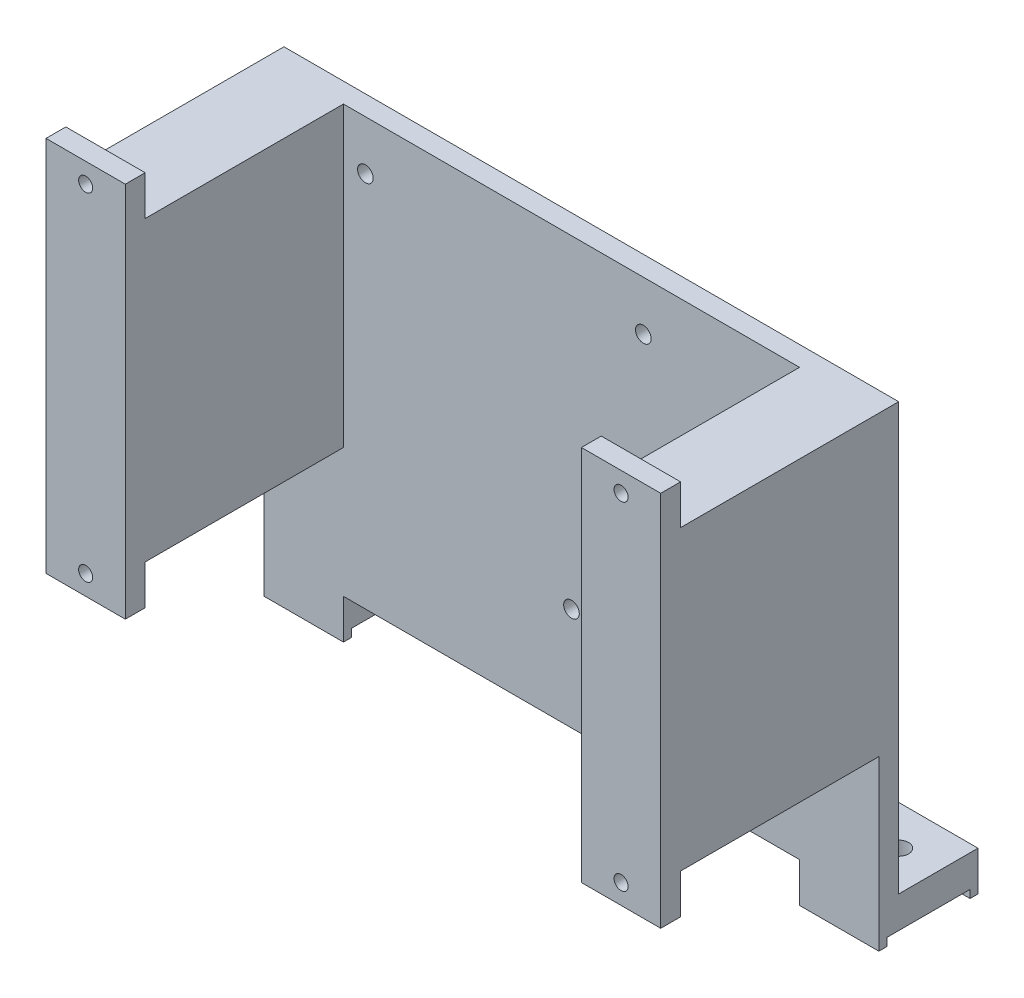
from build123d import *

# Parameters (mm, degrees)
SKETCH1_W                   = 196.85
SKETCH1_H                   = 82.55
BOSS_EXTRUDE1_DEPTH         = 95.25
SKETCH3_W                   = 146.05
SKETCH3_H                   = 76.2
CUT_EXTRUDE1_DEPTH          = 144.051280141
SKETCH4_W                   = 25.4
SKETCH4_H                   = 53.975
BOSS_EXTRUDE2_DEPTH         = 6.35
SKETCH5_W                   = 25.4
SKETCH5_H                   = 12.7
BOSS_EXTRUDE3_DEPTH         = 25.4
SKETCH6_W                   = 26.67
SKETCH6_H                   = 2.54
CUT_EXTRUDE2_DEPTH          = 229.622047548
F_1_4_0_25_DIAMETER_HOLE1_D = 6.35
SKETCH16_W                  = 196.85
SKETCH16_H                  = 6.35
CUT_EXTRUDE3_DEPTH          = 191.790819682
BOSS_EXTRUDE4_START         = -6.35
SKETCH11_W                  = 25.4
SKETCH11_H                  = 12.7
BOSS_EXTRUDE4_DEPTH         = 6.35
F_8_CLEARANCE_HOLE1_D       = 4.4958
F_8_CLEARANCE_HOLE1_DEPTH   = 12.7
SKETCH14_W                  = 146.05
SKETCH14_H                  = 41.275
BOSS_EXTRUDE5_DEPTH         = 6.35
M6X1_0_TAPPED_HOLE1_D       = 5
M6X1_0_TAPPED_HOLE1_DEPTH   = 14.986
M6X1_0_TAPPED_HOLE1_TIP     = 1.502151548


with BuildPart() as part:
    # Sketch1 → Boss-Extrude1 (new body)
    with BuildSketch(Plane(origin=(0, 0, 0), x_dir=(1, 0, 0), z_dir=(0, 1, 0))):
        Rectangle(SKETCH1_W, SKETCH1_H)
    extrude(amount=BOSS_EXTRUDE1_DEPTH)

    # Sketch3 → Cut-Extrude1 (cut, through all)
    with BuildSketch(Plane(origin=(0, 95.25, 0), x_dir=(1, 0, 0), z_dir=(0, 1, 0))):
        with Locations((0, -3.175)):
            Rectangle(SKETCH3_W, SKETCH3_H)
    extrude(amount=-CUT_EXTRUDE1_DEPTH, mode=Mode.SUBTRACT)

    # Sketch4 → Boss-Extrude2 (add)
    with BuildSketch(Plane(origin=(0, 0, -41.275), x_dir=(-1, 0, 0), z_dir=(0, 0, -1))):
        with Locations((-85.725, -26.9875)):
            Rectangle(SKETCH4_W, SKETCH4_H)
    boss_extrude2 = extrude(amount=-BOSS_EXTRUDE2_DEPTH)

    # Sketch5 → Boss-Extrude3 (add)
    with BuildSketch(Plane(origin=(0, 0, -41.275), x_dir=(-1, 0, 0), z_dir=(0, 0, -1))):
        with Locations((-85.725, -47.625)):
            Rectangle(SKETCH5_W, SKETCH5_H)
    boss_extrude3 = extrude(amount=BOSS_EXTRUDE3_DEPTH)

    # Sketch6 → Cut-Extrude2 (cut, through all)
    with BuildSketch(Plane(origin=(98.425, 0, 0), x_dir=(0, 0, -1), z_dir=(1, 0, 0))):
        with Locations((50.8, -52.705)):
            Rectangle(SKETCH6_W, SKETCH6_H)
    cut_extrude2 = extrude(amount=-CUT_EXTRUDE2_DEPTH, mode=Mode.SUBTRACT)

    # 1/4 (0.25) Diameter Hole1 (through all)
    with Locations(Plane(origin=(0, -41.275, 0), x_dir=(1, 0, 0), z_dir=(0, 1, 0))):
        with Locations((85.725, 53.975)):
            f_1_4_0_25_diameter_hole1 = Hole(F_1_4_0_25_DIAMETER_HOLE1_D / 2)

    # Sketch16 → Cut-Extrude3 (cut, through all)
    with BuildSketch(Plane(origin=(0, 95.25, 0), x_dir=(1, 0, 0), z_dir=(0, 1, 0))):
        with Locations((0, -38.1)):
            Rectangle(SKETCH16_W, SKETCH16_H)
    extrude(amount=-CUT_EXTRUDE3_DEPTH, mode=Mode.SUBTRACT)

    # Sketch11 → Boss-Extrude4 (add)
    with BuildSketch(Plane.XY.offset(41.275).offset(BOSS_EXTRUDE4_START)):
        with Locations((85.725, 101.6)):
            Rectangle(SKETCH11_W, SKETCH11_H)
        with Locations((85.725, -6.35)):
            Rectangle(SKETCH11_W, SKETCH11_H)
    boss_extrude4 = extrude(amount=-BOSS_EXTRUDE4_DEPTH)

    # #8 Clearance Hole1
    with Locations(Plane.XY.offset(41.275)):
        with Locations((85.725, 101.6), (85.725, -6.35)):
            f_8_clearance_hole1 = Hole(F_8_CLEARANCE_HOLE1_D / 2, depth=F_8_CLEARANCE_HOLE1_DEPTH)

    # Mirror1: Boss-Extrude2, Boss-Extrude3, Cut-Extrude2, 1/4 (0.25) Diameter Hole1, Boss-Extrude4, #8 Clearance Hole1 across plane
    add(boss_extrude2.mirror(Plane(origin=(0, 0, 0), x_dir=(0, 0, 1), z_dir=(1, 0, 0))))
    add(boss_extrude3.mirror(Plane(origin=(0, 0, 0), x_dir=(0, 0, 1), z_dir=(1, 0, 0))))
    add(cut_extrude2.mirror(Plane(origin=(0, 0, 0), x_dir=(0, 0, 1), z_dir=(1, 0, 0))), mode=Mode.SUBTRACT)
    add(f_1_4_0_25_diameter_hole1.mirror(Plane(origin=(0, 0, 0), x_dir=(0, 0, 1), z_dir=(1, 0, 0))), mode=Mode.SUBTRACT)
    add(boss_extrude4.mirror(Plane(origin=(0, 0, 0), x_dir=(0, 0, 1), z_dir=(1, 0, 0))))
    add(f_8_clearance_hole1.mirror(Plane(origin=(0, 0, 0), x_dir=(0, 0, 1), z_dir=(1, 0, 0))), mode=Mode.SUBTRACT)

    # Sketch14 → Boss-Extrude5 (add)
    with BuildSketch(Plane(origin=(0, 0, -41.275), x_dir=(-1, 0, 0), z_dir=(0, 0, -1))):
        with Locations((0, -20.6375)):
            Rectangle(SKETCH14_W, SKETCH14_H)
    extrude(amount=-BOSS_EXTRUDE5_DEPTH)

    # M6x1.0 Tapped Hole1
    with Locations(Plane(origin=(0, 0, -41.275), x_dir=(-1, 0, 0), z_dir=(0, 0, -1))):
        with Locations((-23, 79.416895565), (66, 79.416895565), (0, -8.333218687)):
            Hole(M6X1_0_TAPPED_HOLE1_D / 2, depth=M6X1_0_TAPPED_HOLE1_DEPTH)
            with Locations((0, 0, -(M6X1_0_TAPPED_HOLE1_DEPTH + M6X1_0_TAPPED_HOLE1_TIP / 2))):  # 118° drill point
                Cone(0, M6X1_0_TAPPED_HOLE1_D / 2, M6X1_0_TAPPED_HOLE1_TIP, mode=Mode.SUBTRACT)


solid = part.part
